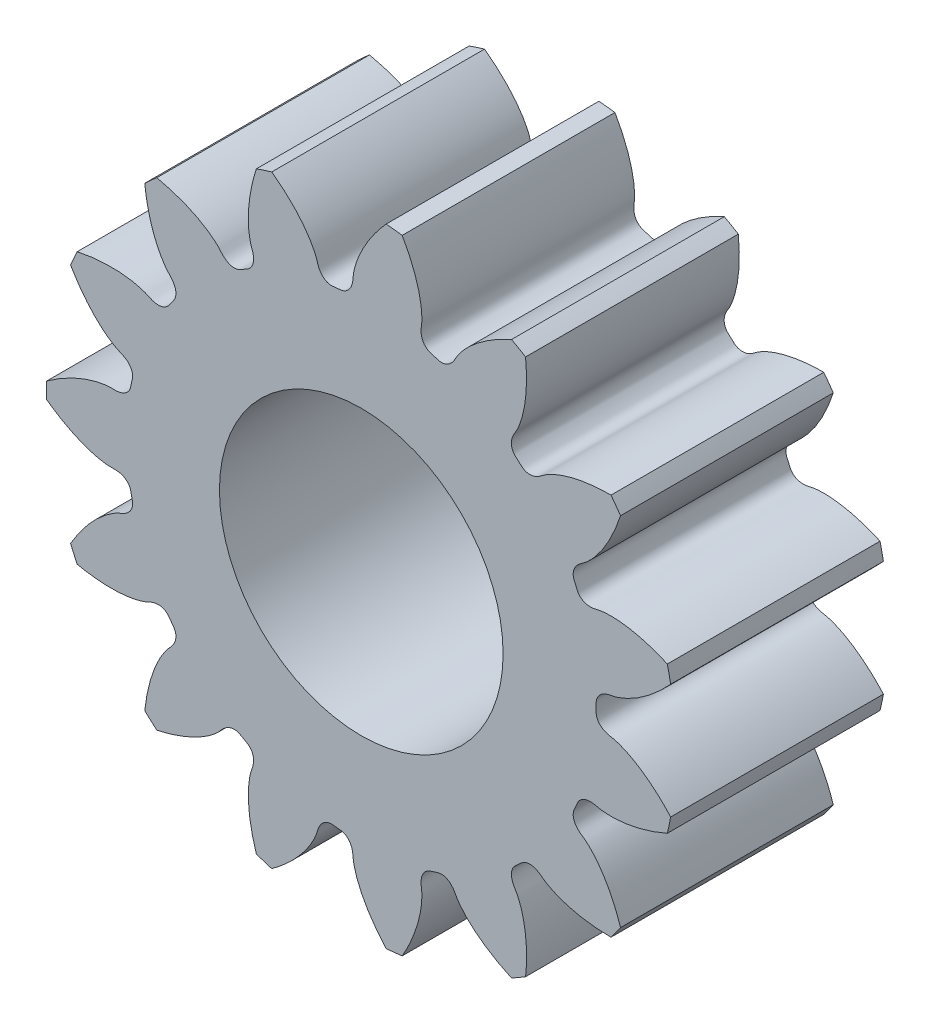
from build123d import *

# Parameters (mm, degrees)
SKETCHREVOLVESPURASSEMBLY02PINION_W       = 6
SKETCHREVOLVESPURASSEMBLY02PINION_H       = 8.875
TOOTHEXTRUDECUTSPURASSEMBLY02PINION_DEPTH = 9.525
PATTERNSPURASSEMBLY02PINION_COUNT         = 15
CUT_EXTRUDE_2_DEPTH                       = 14.893909574
CUT_EXTRUDE_2_DEPTH_BACK                  = 14.893909574
SKETCH_5_R                                = 4


with BuildPart() as part:
    # SketchRevolveSpurAssembly02Pinion → SpurAssembly02Pinion (revolve)
    with BuildSketch(Plane(origin=(0, 0, 0), x_dir=(0, 0, -1), z_dir=(1, 0, 0))):
        with Locations((-6.525, 4.4375)):
            Rectangle(SKETCHREVOLVESPURASSEMBLY02PINION_W, SKETCHREVOLVESPURASSEMBLY02PINION_H)
    revolve(axis=Axis((0, 0, 0), (0, 0, -1)))

    # SketchToothSpurAssembly02Pinion → ToothExtrudeCutSpurAssembly02Pinion (cut, symmetric)
    with BuildSketch(Plane.XY):
        with BuildLine():
            ThreePointArc((8.783330572, 1.686347571), (8.94375, 0), (8.783330572, -1.686347571))
            add(Edge.make_bspline(
                [(8.783330572, -1.686347571), (8.693715743, -1.583742023), (8.557272663, -1.438691826), (8.369391214, -1.26160801), (8.235570357, -1.144996742), (8.105681468, -1.040440966), (7.980449216, -0.947445565), (7.860565205, -0.865477446), (7.746686142, -0.793967662), (7.639432064, -0.732313548), (7.53938489, -0.679879769), (7.447086311, -0.636003578), (7.363038239, -0.599986789), (7.287695595, -0.571130083), (7.22148331, -0.548636286), (7.164740579, -0.531909962), (7.091256208, -0.512763028), (7.028733048, -0.504297167), (6.976668926, -0.491932632), (6.957178273, -0.486786724), (6.937886033, -0.48111657), (6.918753652, -0.474885003), (6.899740075, -0.468034516), (6.880800359, -0.460495838), (6.861886881, -0.452181598), (6.842950733, -0.442983119), (6.823944461, -0.432765435), (6.804826582, -0.421361946), (6.785568821, -0.408568679), (6.76616722, -0.394139087), (6.746658504, -0.37778098), (6.727143019, -0.359158529), (6.707814617, -0.337904051), (6.688995745, -0.313646159), (6.671170078, -0.286061488), (6.655002479, -0.254954989), (6.641309627, -0.220361096), (6.631022567, -0.182651834), (6.625134589, -0.144220834), (6.623189128, -0.083032084), (6.626348174, 0), (6.623189128, 0.083032084), (6.625134589, 0.144220834), (6.631022567, 0.182651834), (6.641309627, 0.220361096), (6.655002479, 0.254954989), (6.671170078, 0.286061488), (6.688995745, 0.313646159), (6.707814617, 0.337904051), (6.727143019, 0.359158529), (6.746658504, 0.37778098), (6.76616722, 0.394139087), (6.785568821, 0.408568679), (6.804826582, 0.421361946), (6.823944461, 0.432765435), (6.842950733, 0.442983119), (6.861886881, 0.452181598), (6.880800359, 0.460495838), (6.899740075, 0.468034516), (6.918753652, 0.474885003), (6.937886033, 0.48111657), (6.957178273, 0.486786724), (6.976668926, 0.491932632), (7.028733048, 0.504297167), (7.091256208, 0.512763028), (7.164740579, 0.531909962), (7.22148331, 0.548636286), (7.287695595, 0.571130083), (7.363038239, 0.599986789), (7.447086311, 0.636003578), (7.53938489, 0.679879769), (7.639432064, 0.732313548), (7.746686142, 0.793967662), (7.860565205, 0.865477446), (7.980449216, 0.947445565), (8.105681468, 1.040440966), (8.235570357, 1.144996742), (8.369391214, 1.26160801), (8.557272663, 1.438691826), (8.693715743, 1.583742023), (8.783330572, 1.686347571)],
                knots=[0, 0, 0, 0, 0.071008254, 0.103709424, 0.134541956, 0.163505849, 0.190601105, 0.215827722, 0.2391857, 0.260675041, 0.280295744, 0.298047808, 0.313931234, 0.327946022, 0.340092173, 0.350369685, 0.358778559, 0.379649637, 0.383167637, 0.38666661, 0.390156188, 0.393647492, 0.397153388, 0.400688784, 0.404270983, 0.407920054, 0.411659242, 0.415515362, 0.419519117, 0.423705232, 0.428112214, 0.432781448, 0.437755221, 0.443073169, 0.448766702, 0.454851287, 0.461317358, 0.468122028, 0.475185097, 0.481525584, 0.5, 0.518474416, 0.524814903, 0.531877972, 0.538682642, 0.545148713, 0.551233298, 0.556926831, 0.562244779, 0.567218552, 0.571887786, 0.576294768, 0.580480883, 0.584484638, 0.588340758, 0.592079946, 0.595729017, 0.599311216, 0.602846612, 0.606352508, 0.609843812, 0.61333339, 0.616832363, 0.620350363, 0.641221441, 0.649630315, 0.659907827, 0.672053978, 0.686068766, 0.701952192, 0.719704256, 0.739324959, 0.7608143, 0.784172278, 0.809398895, 0.836494151, 0.865458044, 0.896290576, 0.928991746, 1, 1, 1, 1], degree=3))
        make_face()
    toothextrudecutspurassembly02pinion = extrude(amount=TOOTHEXTRUDECUTSPURASSEMBLY02PINION_DEPTH, both=True, mode=Mode.SUBTRACT)

    # PatternSpurAssembly02Pinion: ToothExtrudeCutSpurAssembly02Pinion ×15 about axis
    patternspurassembly02pinion_axis = Axis((0, 0, 50), (0, 0, -1))
    for i in range(1, PATTERNSPURASSEMBLY02PINION_COUNT):
        add(toothextrudecutspurassembly02pinion.rotate(patternspurassembly02pinion_axis, i * 360 / PATTERNSPURASSEMBLY02PINION_COUNT), mode=Mode.SUBTRACT)

    # Эскиз5 → Вырез-Вытянуть2 (cut, two sides: drawn at the far end of the back side and taken through both)
    with BuildSketch(Plane.XY.offset(9.525).offset(-CUT_EXTRUDE_2_DEPTH_BACK)):
        Circle(SKETCH_5_R)
    extrude(amount=CUT_EXTRUDE_2_DEPTH + CUT_EXTRUDE_2_DEPTH_BACK, mode=Mode.SUBTRACT)


solid = part.part
